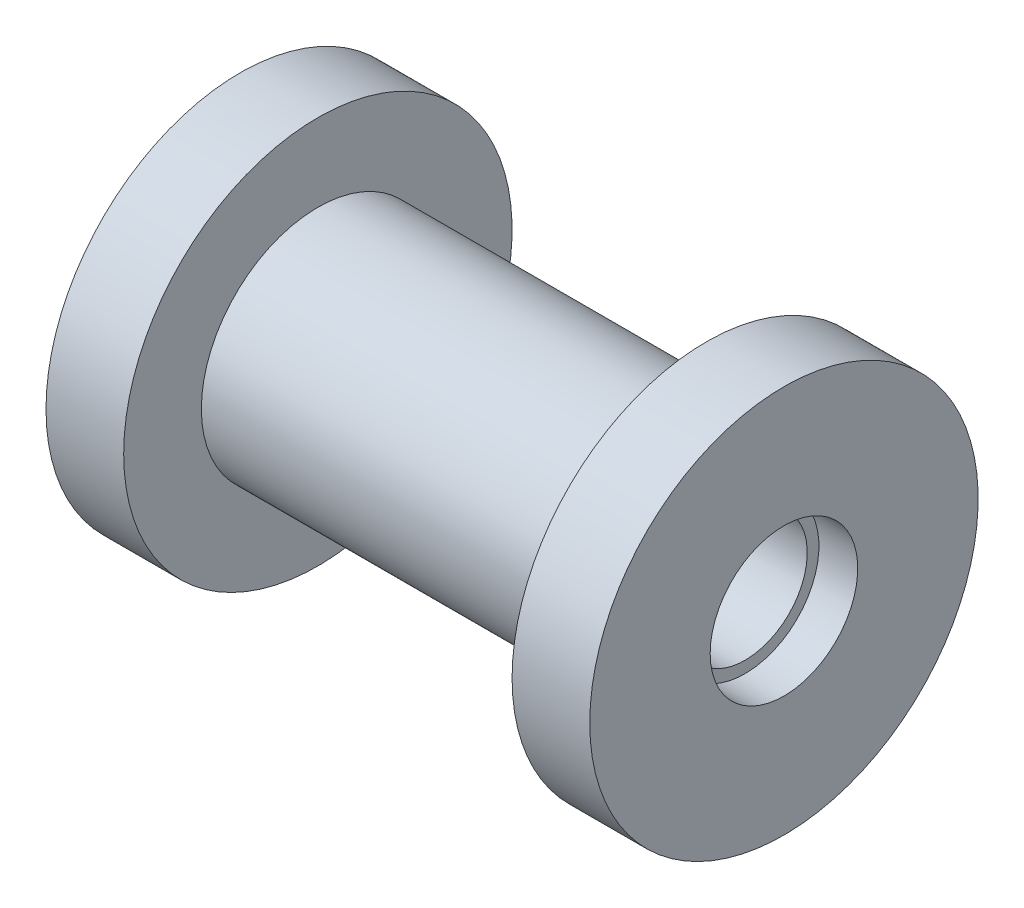
from build123d import *


with BuildPart() as part:
    # 草图1 → 旋转2 (revolve)
    with BuildSketch(Plane.XY, mode=Mode.PRIVATE) as revolve_2_sk:
        Polygon((5, 9.5), (5, 8), (65, 8), (65, 9.5), (70, 9.5), (70, 25), (60, 25), (60, 15), (10, 15), (10, 25), (0, 25), (0, 9.5), align=None)
    revolve(revolve_2_sk.sketch.rotate(Axis((-69.394375711, 0, 0), (1, 0, 0)), 90), axis=Axis((-69.394375711, 0, 0), (1, 0, 0)))


solid = part.part
